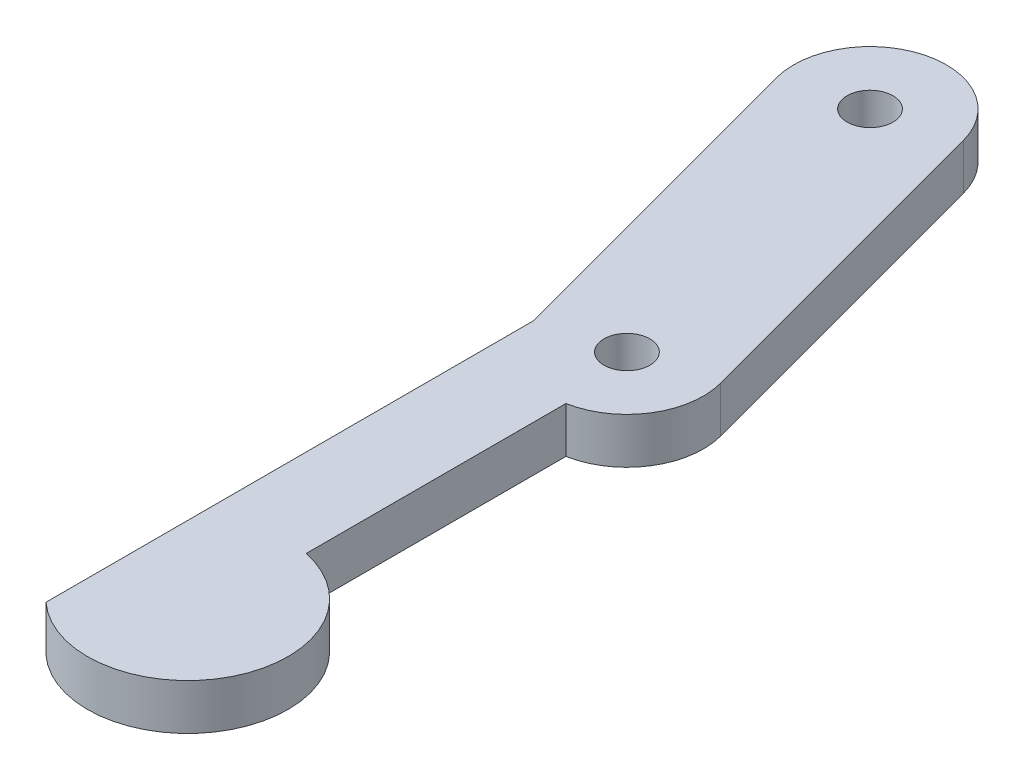
from build123d import *

# Parameters (mm, degrees)
SKETCH1_R           = 1.5
BOSS_EXTRUDE1_DEPTH = 3


with BuildPart() as part:
    # Sketch1 → Boss-Extrude1 (new body)
    with BuildSketch(Plane(origin=(0, 0, 0), x_dir=(1, 0, 0), z_dir=(0, 1, 0))):
        with BuildLine():
            ThreePointArc((10.653057646, -20.439235866), (10.054560804, -24.397448123), (6.743799383, -26.647892869))
            Line((6.743799383, -26.647892869), (6.743799383, -43.647892869))
            ThreePointArc((6.743799383, -43.647892869), (11.280986361, -53.065151094), (0.993799383, -54.921115062))
            Line((0.993799383, -54.921115062), (0.993799383, -43.647892869))
            Line((0.993799383, -43.647892869), (0.993799383, -23.027426317))
            Line((0.993799383, -23.027426317), (-4.829629131, -1.294095226))
            ThreePointArc((-4.829629131, -1.294095226), (-1.294095226, 4.829629131), (4.829629131, 1.294095226))
            Line((4.829629131, 1.294095226), (10.653057646, -20.439235866))
        make_face()
        with Locations(Location((5.823428515, -21.733331092, 0), (0, 0, 270))):
            Circle(SKETCH1_R, mode=Mode.SUBTRACT)
        with Locations(Location((0, 0, 0), (0, 0, 270))):
            Circle(SKETCH1_R, mode=Mode.SUBTRACT)
    extrude(amount=BOSS_EXTRUDE1_DEPTH)


solid = part.part
